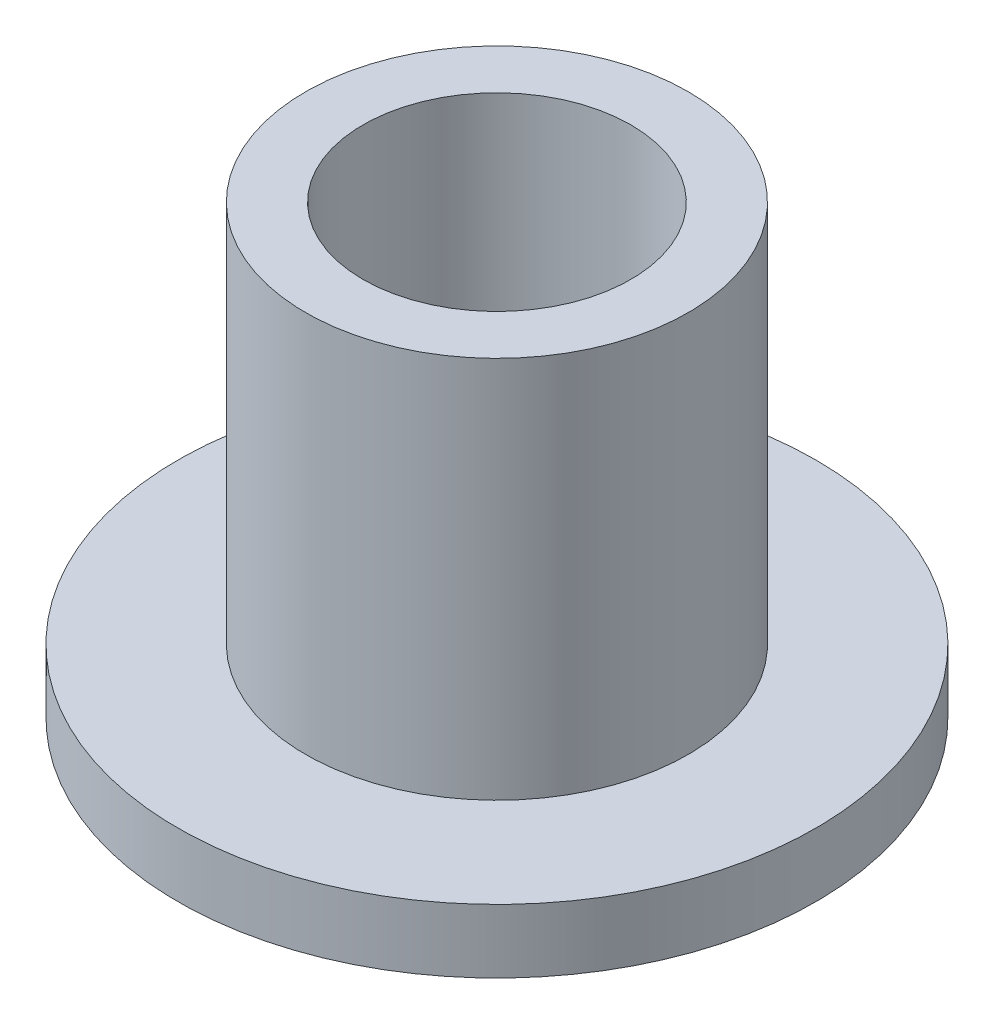
from build123d import *

# Parameters (mm, degrees)
F_4_2MM_DOWEL_HOLE1_D = 4.2


with BuildPart() as part:
    # Sketch1 → Revolve1 (revolve)
    with BuildSketch(Plane.XY, mode=Mode.PRIVATE) as revolve1_sk:
        Polygon((0, 0), (-5, 0), (-5, 1), (-3, 1), (-3, 7), (0, 7), align=None)
    revolve(revolve1_sk.sketch.rotate(Axis((0, 0, 0), (0, 1, 0)), 270), axis=Axis((0, 0, 0), (0, 1, 0)))

    # Ø4.2mm Dowel Hole1 (through all)
    with Locations(Plane(origin=(0, 7, 0), x_dir=(1, 0, 0), z_dir=(0, 1, 0))):
        with Locations((0, 0)):
            Hole(F_4_2MM_DOWEL_HOLE1_D / 2)


solid = part.part
